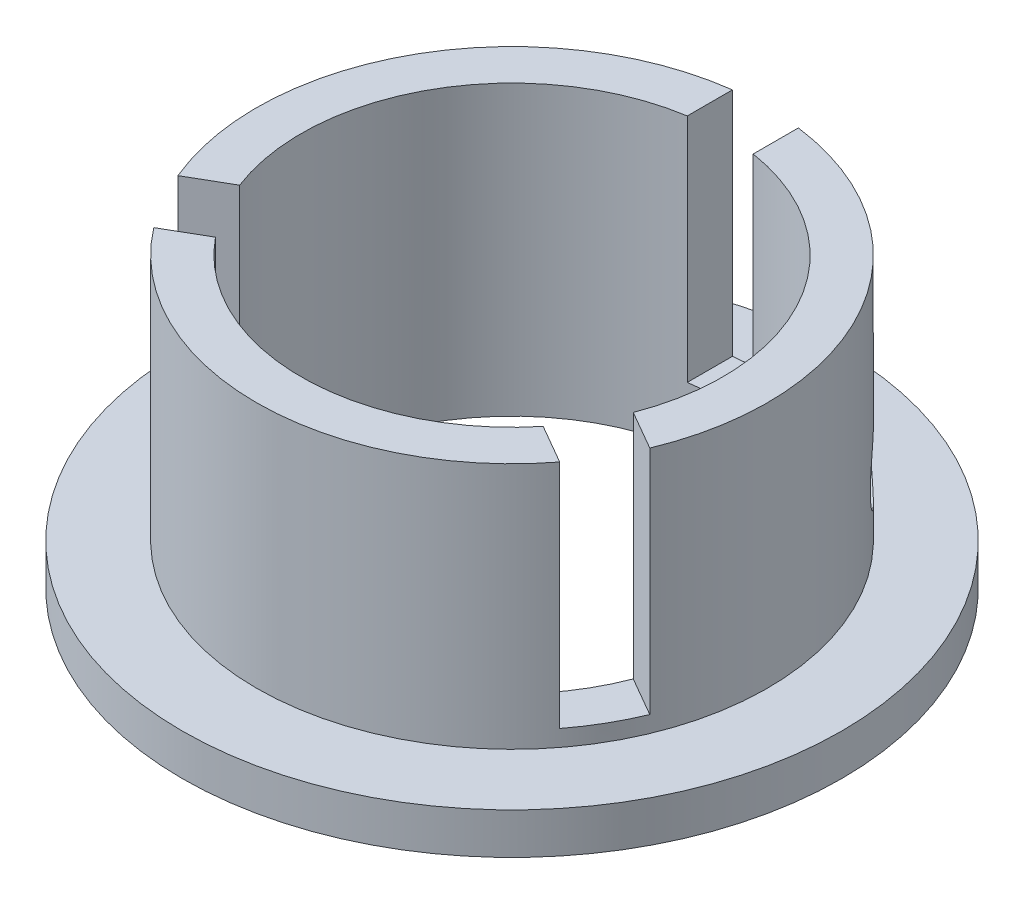
from build123d import *

# Parameters (mm, degrees)
CROQUIS1_R              = 20
CROQUIS1_R_2            = 12.789172095
SALIENTE_EXTRUIR1_DEPTH = 2.5
CROQUIS2_R              = 15.5
CROQUIS2_R_2            = 12.789172095
SALIENTE_EXTRUIR2_DEPTH = 15
CORTAR_EXTRUIR1_START   = -14
CORTAR_EXTRUIR1_DEPTH   = 14
MATRIZC1_COUNT          = 3
CROQUIS4_R              = 2
CORTAR_EXTRUIR2_DEPTH   = 17


with BuildPart() as part:
    # Croquis1 → Saliente-Extruir1 (new body)
    with BuildSketch(Plane(origin=(0, 0, 0), x_dir=(1, 0, 0), z_dir=(0, 1, 0))):
        with Locations(Location((0, 0, 0), (0, 0, 270))):
            Circle(CROQUIS1_R)
        with Locations(Location((0, 0, 0), (0, 0, 270))):
            Circle(CROQUIS1_R_2, mode=Mode.SUBTRACT)
    extrude(amount=SALIENTE_EXTRUIR1_DEPTH)

    # Croquis2 → Saliente-Extruir2 (add)
    with BuildSketch(Plane(origin=(0, 2.5, 0), x_dir=(1, 0, 0), z_dir=(0, 1, 0))):
        with Locations(Location((0, 0, 0), (0, 0, 270))):
            Circle(CROQUIS2_R)
        with Locations(Location((0, 0, 0), (0, 0, 270))):
            Circle(CROQUIS2_R_2, mode=Mode.SUBTRACT)
    extrude(amount=SALIENTE_EXTRUIR2_DEPTH)

    # Croquis3 → Cortar-Extruir1 (cut)
    with BuildSketch(Plane(origin=(0, 17.5, 0), x_dir=(1, 0, 0), z_dir=(0, 1, 0)).offset(CORTAR_EXTRUIR1_START)):
        with BuildLine():
            Line((2, 15.370426149), (2, 12.631821835))
            ThreePointArc((2, 12.631821835), (0, 12.789172095), (-2, 12.631821835))
            Line((-2, 12.631821835), (-2, 15.370426149))
            ThreePointArc((-2, 15.370426149), (0, 15.5), (2, 15.370426149))
        make_face()
    cortar_extruir1 = extrude(amount=CORTAR_EXTRUIR1_DEPTH, mode=Mode.SUBTRACT)

    # MatrizC1: Cortar-Extruir1 ×3 about axis
    matrizc1_axis = Axis((0, 0, 0), (0, 1, 0))
    for i in range(1, MATRIZC1_COUNT):
        add(cortar_extruir1.rotate(matrizc1_axis, i * 360 / MATRIZC1_COUNT), mode=Mode.SUBTRACT)

    # Croquis4 → Cortar-Extruir2 (cut)
    with BuildSketch(Plane(origin=(0, 0, 0), x_dir=(0.7071067811865477, 0, 0.7071067811865475), z_dir=(-0.7071067811865475, 0, 0.7071067811865477))):
        with Locations((0, 6.5)):
            Circle(CROQUIS4_R)
    extrude(amount=-CORTAR_EXTRUIR2_DEPTH, mode=Mode.SUBTRACT)


solid = part.part
